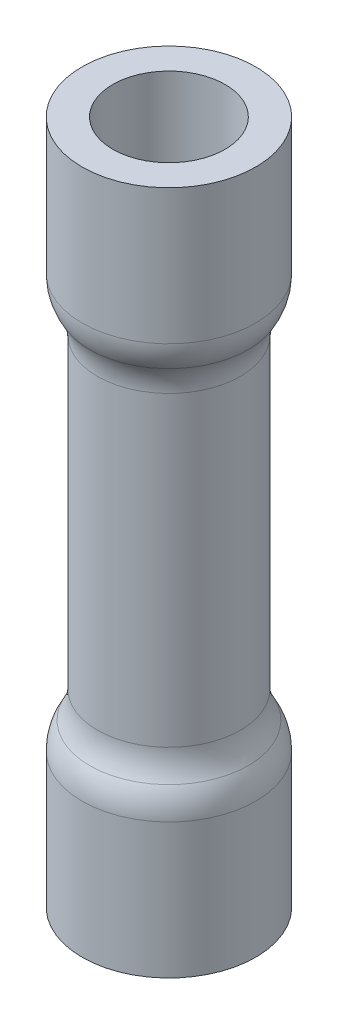
from build123d import *


with BuildPart() as part:
    # Sketch1 → Revolve-Thin1 (revolve)
    with BuildSketch(Plane.XY, mode=Mode.PRIVATE) as revolve_thin1_sk:
        with BuildLine():
            Line((2.159, 17.018), (2.159, 13.657028027))
            ThreePointArc((2.159, 13.657028027), (2.110446888, 13.309224203), (1.9685, 12.988014013))
            ThreePointArc((1.9685, 12.988014013), (1.826553112, 12.666803824), (1.778, 12.319))
            Line((1.778, 12.319), (1.778, 4.699))
            ThreePointArc((1.778, 4.699), (1.826553112, 4.351196176), (1.9685, 4.029985987))
            ThreePointArc((1.9685, 4.029985987), (2.110446888, 3.708775797), (2.159, 3.360971973))
            Line((2.159, 3.360971973), (2.159, 0))
            Line((2.159, 0), (1.397, 0))
            Line((1.397, 0), (1.397, 3.360971973))
            ThreePointArc((1.397, 3.360971973), (1.377578755, 3.500093503), (1.3208, 3.628577579))
            ThreePointArc((1.3208, 3.628577579), (1.093684979, 4.142513882), (1.016, 4.699))
            Line((1.016, 4.699), (1.016, 12.319))
            ThreePointArc((1.016, 12.319), (1.093684979, 12.875486118), (1.3208, 13.389422421))
            ThreePointArc((1.3208, 13.389422421), (1.377578755, 13.517906497), (1.397, 13.657028027))
            Line((1.397, 13.657028027), (1.397, 17.018))
            Line((1.397, 17.018), (2.159, 17.018))
        make_face()
    revolve(revolve_thin1_sk.sketch.rotate(Axis((0, 17.018, 0), (0, -1, 0)), 90), axis=Axis((0, 17.018, 0), (0, -1, 0)))


solid = part.part
